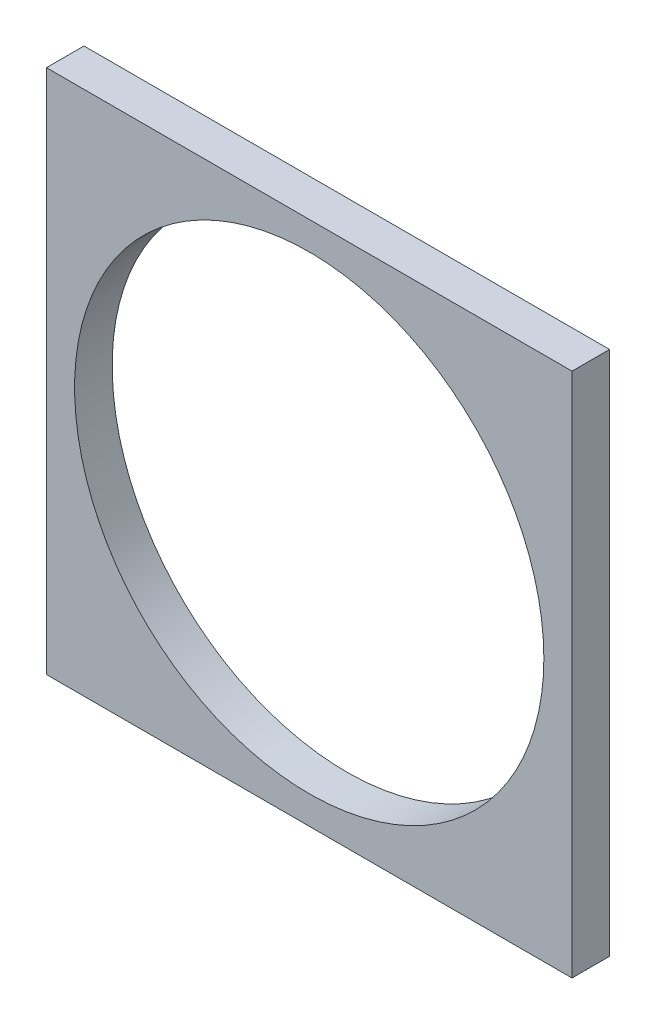
from build123d import *

# Parameters (mm, degrees)
SKETCH1_W           = 14
SKETCH1_H           = 14
SKETCH1_R           = 6.25
BOSS_EXTRUDE1_DEPTH = 1


with BuildPart() as part:
    # Sketch1 → Boss-Extrude1 (new body)
    with BuildSketch(Plane.XY):
        Rectangle(SKETCH1_W, SKETCH1_H)
        Circle(SKETCH1_R, mode=Mode.SUBTRACT)
    extrude(amount=BOSS_EXTRUDE1_DEPTH)


solid = part.part
